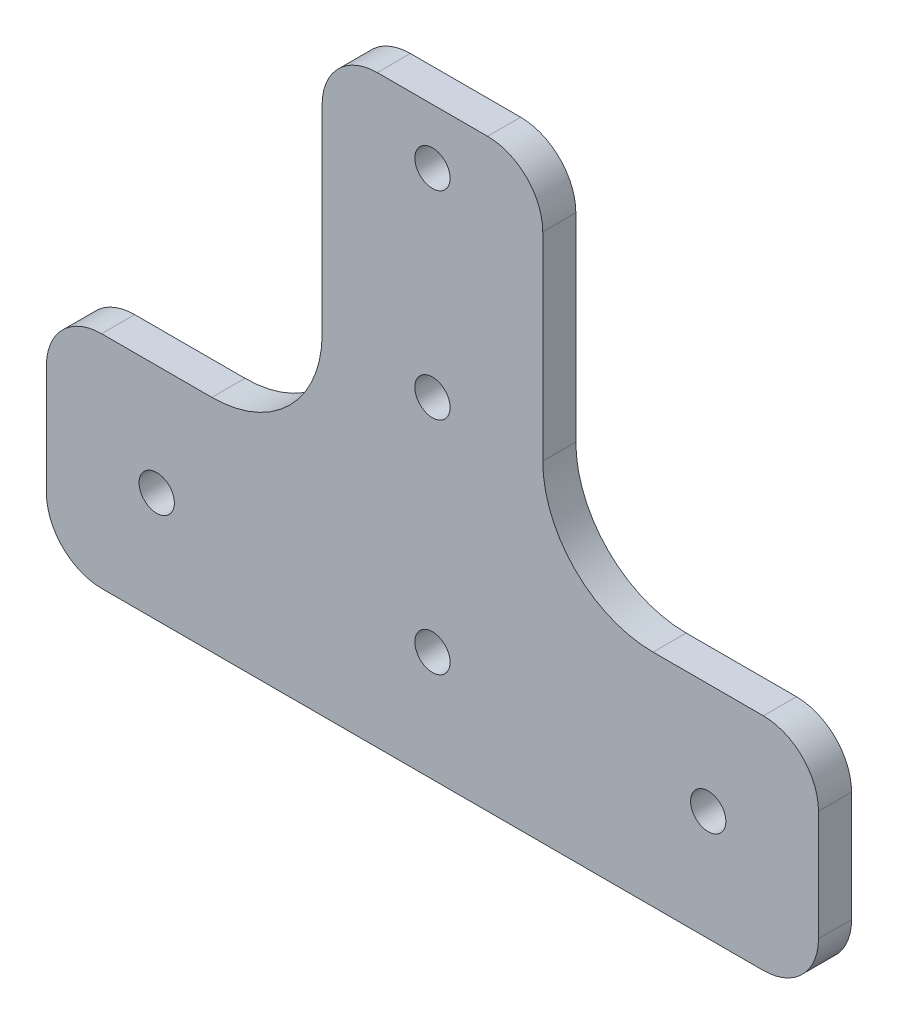
from build123d import *

# Parameters (mm, degrees)
SKETCH_1_W          = 20
SKETCH_1_H          = 53
EXTRUDE_1_DEPTH     = 3
SKETCH_2_W          = 70
SKETCH_2_H          = 20
EXTRUDE_2_DEPTH     = 3
SKETCH_3_R          = 1.6
CUT_EXTRUDE_1_DEPTH = 70.591666168
FILLET_1_R          = 10
FILLET_2_R          = 5


with BuildPart() as part:
    # 草图1 → 凸台-拉伸1 (new body)
    with BuildSketch(Plane.XY):
        with Locations((10, 26.5)):
            Rectangle(SKETCH_1_W, SKETCH_1_H)
    extrude(amount=EXTRUDE_1_DEPTH)

    # 草图2 → 凸台-拉伸2 (add)
    with BuildSketch(Plane.XY.offset(3)):
        with Locations((10, 10)):
            Rectangle(SKETCH_2_W, SKETCH_2_H)
    extrude(amount=-EXTRUDE_2_DEPTH)

    # 草图3 → 切除-拉伸1 (cut, through all)
    with BuildSketch(Plane.XY.offset(3)):
        with Locations((10, 48)):
            Circle(SKETCH_3_R)
        with Locations((10, 30)):
            Circle(SKETCH_3_R)
        with Locations((10, 10)):
            Circle(SKETCH_3_R)
        with Locations((-15, 10)):
            Circle(SKETCH_3_R)
        with Locations((35, 10)):
            Circle(SKETCH_3_R)
    extrude(amount=-CUT_EXTRUDE_1_DEPTH, mode=Mode.SUBTRACT)

    # 圆角1
    fillet_1_edges = [part.edges().sort_by_distance(p)[0] for p in [
        (0, 20, 1.5),
        (20, 20, 1.5),
    ]]
    fillet(fillet_1_edges, radius=FILLET_1_R)

    # 圆角2
    fillet_2_edges = [part.edges().sort_by_distance(p)[0] for p in [
        (-25, 20, 1.5),
        (45, 0, 1.5),
        (-25, 0, 1.5),
        (45, 20, 1.5),
        (0, 53, 1.5),
        (20, 53, 1.5),
    ]]
    fillet(fillet_2_edges, radius=FILLET_2_R)


solid = part.part
